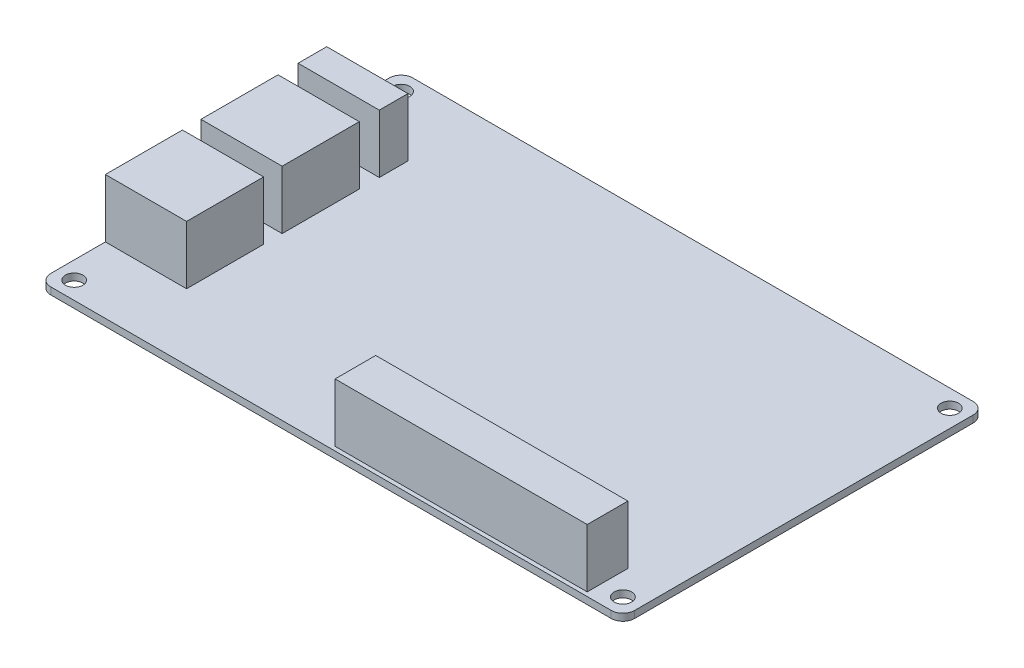
from build123d import *

# Parameters (mm, degrees)
SKETCH_1_R      = 1.5
EXTRUDE_1_DEPTH = 1.2
SKETCH_2_W      = 13.910579459
SKETCH_2_H      = 13.201638929
SKETCH_2_H_2    = 13.209823538
SKETCH_2_H_3    = 4.905965234
EXTRUDE_2_DEPTH = 10
SKETCH_3_W      = 43.193790083
SKETCH_3_H      = 6.962206473
EXTRUDE_3_DEPTH = 10


with BuildPart() as part:
    # 草图1 → 凸台-拉伸1 (new body)
    with BuildSketch(Plane(origin=(0, 0, 0), x_dir=(1, 0, 0), z_dir=(0, 1, 0))):
        with BuildLine():
            Line((48, -31), (-48, -31))
            ThreePointArc((-48, -31), (-49.414213562, -30.414213562), (-50, -29))
            Line((-50, -29), (-50, 29))
            ThreePointArc((-50, 29), (-49.414213562, 30.414213562), (-48, 31))
            Line((-48, 31), (48, 31))
            ThreePointArc((48, 31), (49.414213562, 30.414213562), (50, 29))
            Line((50, 29), (50, -29))
            ThreePointArc((50, -29), (49.414213562, -30.414213562), (48, -31))
        make_face()
        with Locations(Location((-47, 28, 0), (0, 0, 270))):
            Circle(SKETCH_1_R, mode=Mode.SUBTRACT)
        with Locations(Location((47, 28, 0), (0, 0, 270))):
            Circle(SKETCH_1_R, mode=Mode.SUBTRACT)
        with Locations(Location((47, -28, 0), (0, 0, 270))):
            Circle(SKETCH_1_R, mode=Mode.SUBTRACT)
        with Locations(Location((-47, -28, 0), (0, 0, 270))):
            Circle(SKETCH_1_R, mode=Mode.SUBTRACT)
    extrude(amount=EXTRUDE_1_DEPTH)

    # 草图2 → 凸台-拉伸2 (add)
    with BuildSketch(Plane(origin=(0, 1.2, 0), x_dir=(1, 0, 0), z_dir=(0, 1, 0))):
        with Locations((-43.044710271, -13.054661049)):
            Rectangle(SKETCH_2_W, SKETCH_2_H)
        with Locations((-43.044710271, 3.320886699)):
            Rectangle(SKETCH_2_W, SKETCH_2_H_2)
        with Locations((-43.044710271, 15.810299107)):
            Rectangle(SKETCH_2_W, SKETCH_2_H_3)
    extrude(amount=EXTRUDE_2_DEPTH)

    # 草图3 → 凸台-拉伸3 (add)
    with BuildSketch(Plane(origin=(0, 1.2, 0), x_dir=(1, 0, 0), z_dir=(0, 1, 0))):
        with Locations((21.596895042, -26.824460666)):
            Rectangle(SKETCH_3_W, SKETCH_3_H)
    extrude(amount=EXTRUDE_3_DEPTH)


solid = part.part
